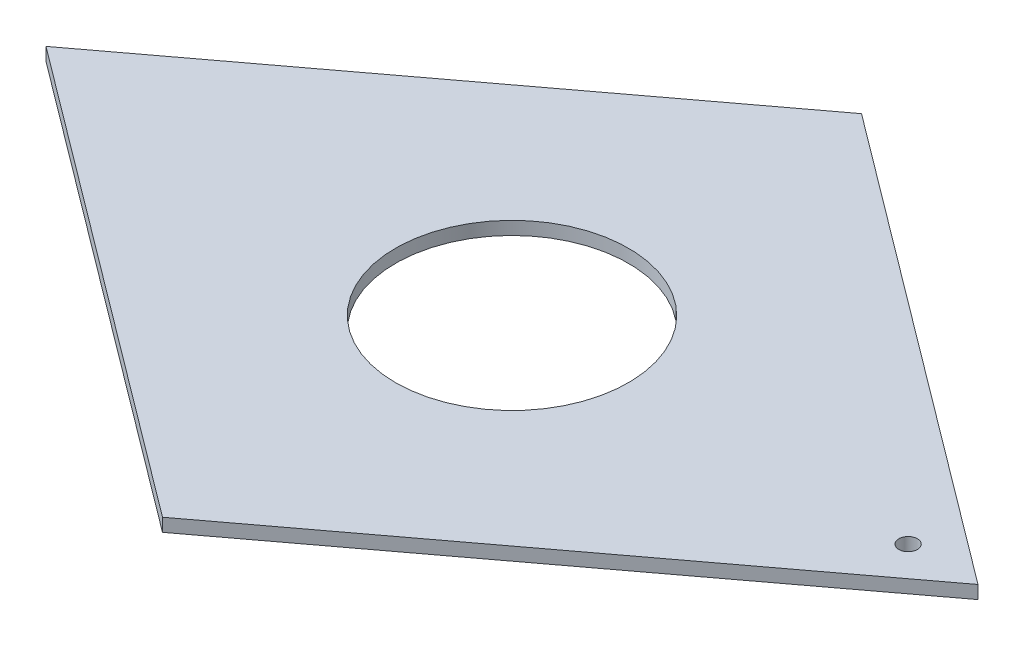
from build123d import *

# Parameters (mm, degrees)
SKETCH1_R           = 50
SKETCH1_R_2         = 4
BOSS_EXTRUDE1_DEPTH = 5.63


with BuildPart() as part:
    # Sketch1 → Boss-Extrude1 (new body)
    with BuildSketch(Plane(origin=(0, 0, 0), x_dir=(1, 0, 0), z_dir=(0, 1, 0))):
        Polygon((0, 150), (200, 0), (0, -150), (-200, 0), align=None)
        with Locations(Location((0, 0, 0), (0, 0, 270))):
            Circle(SKETCH1_R, mode=Mode.SUBTRACT)
        with Locations(Location((170, 0, 0), (0, 0, 270))):
            Circle(SKETCH1_R_2, mode=Mode.SUBTRACT)
    extrude(amount=BOSS_EXTRUDE1_DEPTH)


solid = part.part
